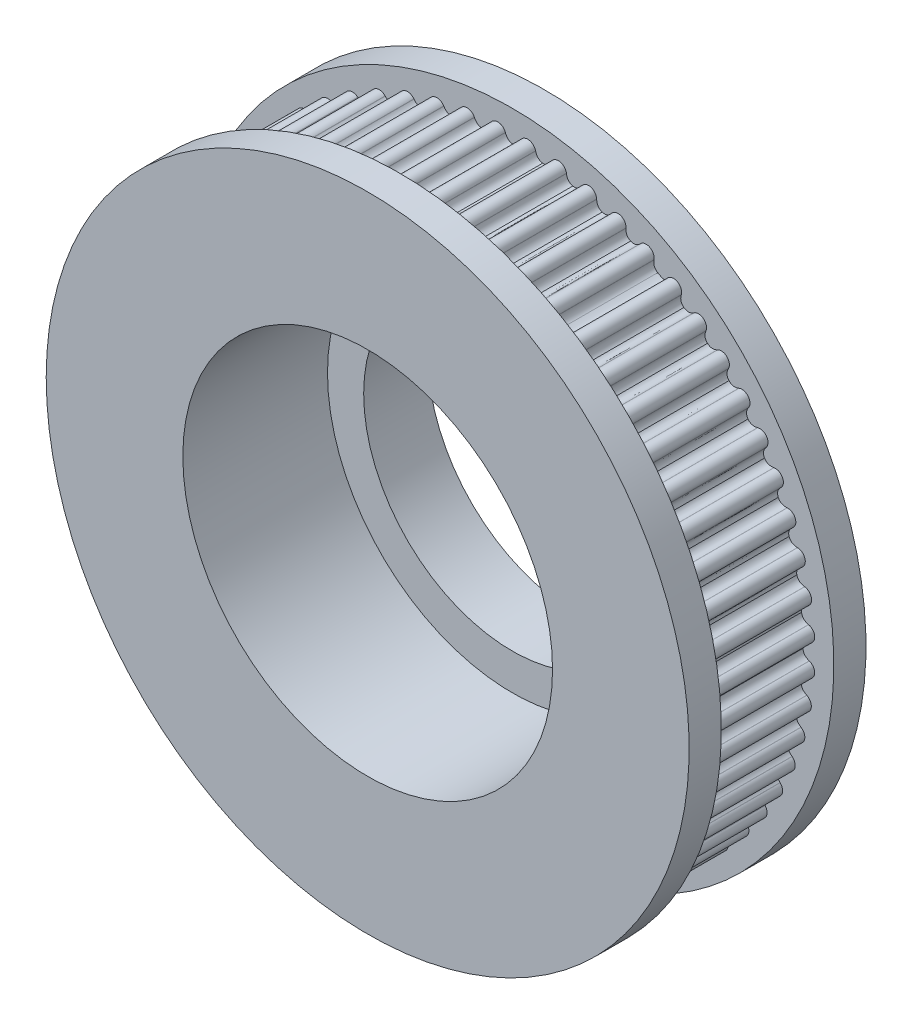
from build123d import *

# Parameters (mm, degrees)
SKETCH3_OUTSIDE_W      = 53.608
SKETCH3_OUTSIDE_H      = 53.608
CUT_EXTRUDE1_DEPTH     = 7
SPLIT1_SURFACE_1_BACK  = 59.043
SPLIT1_SURFACE_1_DEPTH = 118.086
SPLIT1_SURFACE_2_BACK  = 59.043
SPLIT1_SURFACE_2_DEPTH = 118.086


with BuildPart() as part:
    # Sketch1 → Revolve1 (revolve)
    with BuildSketch(Plane(origin=(0, 0, 0), x_dir=(0, 0, -1), z_dir=(1, 0, 0)), mode=Mode.PRIVATE) as revolve1_sk:
        Polygon((0, 11.25), (-2, 11.25), (-2, 11.5), (-2, 18.85), (-2, 20), (-4, 20), (-4, 18.85), (-11, 18.85), (-11, 20), (-13, 20), (-13, 18.85), (-13, 11.5), (-4, 11.5), (-4, 9.25), (0, 9.25), align=None)
    revolve(revolve1_sk.sketch.rotate(Axis((0, 0, 0), (0, 0, 1)), 90), axis=Axis((0, 0, 0), (0, 0, 1)))

    # Sketch3 outside → Cut-Extrude1 (cut)
    with BuildSketch(Plane.XY.offset(4)):
        Rectangle(SKETCH3_OUTSIDE_W, SKETCH3_OUTSIDE_H)
        with BuildLine():
            Line((0.48954913, 18.480375333), (0.485818632, 18.469717385))
            add(Edge.make_bspline(
                [(0.485818632, 18.469717385), (0.407741985, 18.249527558), (0.24028179, 18.086154527), (0.026214695, 18.085070307)],
                knots=[0, 0, 0, 0, 1, 1, 1, 1], degree=3))
            add(Edge.make_bspline(
                [(0.026214695, 18.085070307), (-0.187846082, 18.086775093), (-0.354832577, 18.250628249), (-0.432269829, 18.471041123)],
                knots=[0, 0, 0, 0, 1, 1, 1, 1], degree=3))
            Line((-0.432269829, 18.471041123), (-0.435971787, 18.481716895))
            ThreePointArc((-0.435971787, 18.481716895), (-0.931215069, 18.811965966), (-1.391421689, 18.434420969))
            Line((-1.391421689, 18.434420969), (-1.394049444, 18.423439012))
            add(Edge.make_bspline(
                [(-1.394049444, 18.423439012), (-1.451513615, 18.187532894), (-1.598236067, 18.015569009), (-1.838247448, 17.991333228)],
                knots=[0, 0, 0, 0, 1, 1, 1, 1], degree=3))
            add(Edge.make_bspline(
                [(-1.838247448, 17.991333228), (-2.078200755, 17.966529071), (-2.256668862, 18.105266918), (-2.36065454, 18.324677051)],
                knots=[0, 0, 0, 0, 1, 1, 1, 1], degree=3))
            Line((-2.36065454, 18.324677051), (-2.365448953, 18.334900655))
            ThreePointArc((-2.365448953, 18.334900655), (-2.892499669, 18.611573568), (-3.310721031, 18.187992112))
            Line((-3.310721031, 18.187992112), (-3.312186463, 18.176795639))
            add(Edge.make_bspline(
                [(-3.312186463, 18.176795639), (-3.344676936, 17.936175198), (-3.472620506, 17.749816677), (-3.70878375, 17.700625641)],
                knots=[0, 0, 0, 0, 1, 1, 1, 1], degree=3))
            add(Edge.make_bspline(
                [(-3.70878375, 17.700625641), (-3.944829828, 17.650875413), (-4.136822322, 17.770198244), (-4.26317296, 17.977536961)],
                knots=[0, 0, 0, 0, 1, 1, 1, 1], degree=3))
            Line((-4.26317296, 17.977536961), (-4.269009766, 17.987203407))
            ThreePointArc((-4.269009766, 17.987203407), (-4.822093437, 18.207268875), (-5.19374742, 17.742291806))
            Line((-5.19374742, 17.742291806), (-5.194034475, 17.73100349))
            add(Edge.make_bspline(
                [(-5.194034475, 17.73100349), (-5.201195276, 17.488305014), (-5.308958188, 17.289593639), (-5.538685842, 17.215986296)],
                knots=[0, 0, 0, 0, 1, 1, 1, 1], degree=3))
            add(Edge.make_bspline(
                [(-5.538685842, 17.215986296), (-5.76823852, 17.141835071), (-5.971651891, 17.240435558), (-6.118983164, 17.433431215)],
                knots=[0, 0, 0, 0, 1, 1, 1, 1], degree=3))
            Line((-6.118983164, 17.433431215), (-6.125798415, 17.442434594))
            ThreePointArc((-6.125798415, 17.442434594), (-6.698855341, 17.603481534), (-7.019870025, 17.102203239))
            Line((-7.019870025, 17.102203239), (-7.018975557, 17.090946756))
            add(Edge.make_bspline(
                [(-7.018975557, 17.090946756), (-7.000728232, 16.848829299), (-7.087129813, 16.639942195), (-7.307904932, 16.542725002)],
                knots=[0, 0, 0, 0, 1, 1, 1, 1], degree=3))
            add(Edge.make_bspline(
                [(-7.307904932, 16.542725002), (-7.528449183, 16.444985197), (-7.741054792, 16.521783053), (-7.907752509, 16.698321148)],
                knots=[0, 0, 0, 0, 1, 1, 1, 1], degree=3))
            Line((-7.907752509, 16.698321148), (-7.915471534, 16.706562818))
            ThreePointArc((-7.915471534, 16.706562818), (-8.502223183, 16.806826766), (-8.769081466, 16.274739354))
            Line((-8.769081466, 16.274739354), (-8.767015275, 16.263638033))
            add(Edge.make_bspline(
                [(-8.767015275, 16.263638033), (-8.723559745, 16.024754286), (-8.787653361, 15.807980062), (-8.997057087, 15.688218151)],
                knots=[0, 0, 0, 0, 1, 1, 1, 1], degree=3))
            add(Edge.make_bspline(
                [(-8.997057087, 15.688218151), (-9.206176582, 15.567960623), (-9.425645077, 15.622114435), (-9.609882862, 15.78026078)],
                knots=[0, 0, 0, 0, 1, 1, 1, 1], degree=3))
            Line((-9.609882862, 15.78026078), (-9.61842109, 15.787650443))
            ThreePointArc((-9.61842109, 15.787650443), (-10.212438889, 15.826032887), (-10.422217015, 15.268966019))
            Line((-10.422217015, 15.268966019), (-10.419001739, 15.258141488))
            add(Edge.make_bspline(
                [(-10.419001739, 15.258141488), (-10.350814112, 15.025108711), (-10.391897539, 14.802822392), (-10.587635602, 14.6618279)],
                knots=[0, 0, 0, 0, 1, 1, 1, 1], degree=3))
            add(Edge.make_bspline(
                [(-10.587635602, 14.6618279), (-10.783039184, 14.520370216), (-11.006966022, 14.551286663), (-11.206725327, 14.689308572)],
                knots=[0, 0, 0, 0, 1, 1, 1, 1], degree=3))
            Line((-11.206725327, 14.689308572), (-11.215989213, 14.695765267))
            ThreePointArc((-11.215989213, 14.695765267), (-11.810764978, 14.671845679), (-11.961164573, 14.095902697))
            Line((-11.961164573, 14.095902697), (-11.956835439, 14.085473551))
            add(Edge.make_bspline(
                [(-11.956835439, 14.085473551), (-11.864662793, 13.8608449), (-11.882285914, 13.635481902), (-12.062213765, 13.474799593)],
                knots=[0, 0, 0, 0, 1, 1, 1, 1], degree=3))
            add(Edge.make_bspline(
                [(-12.062213765, 13.474799593), (-12.241760551, 13.313691593), (-12.467692344, 13.321031948), (-12.680784565, 13.437417226)],
                knots=[0, 0, 0, 0, 1, 1, 1, 1], degree=3))
            Line((-12.680784565, 13.437417226), (-12.69067261, 13.442870211))
            ThreePointArc((-12.69067261, 13.442870211), (-13.279689854, 13.356910661), (-13.36906311, 12.768401715))
            Line((-13.36906311, 12.768401715), (-13.363667548, 12.75848222))
            add(Edge.make_bspline(
                [(-13.363667548, 12.75848222), (-13.248519746, 12.544718773), (-13.242489477, 12.318748218), (-13.404635791, 12.140138563)],
                knots=[0, 0, 0, 0, 1, 1, 1, 1], degree=3))
            add(Edge.make_bspline(
                [(-13.404635791, 12.140138563), (-13.566358629, 11.961145379), (-13.791820019, 11.94482922), (-14.015910473, 12.038302725)],
                knots=[0, 0, 0, 0, 1, 1, 1, 1], degree=3))
            Line((-14.015910473, 12.038302725), (-14.026314343, 12.042692255))
            ThreePointArc((-14.026314343, 12.042692255), (-14.603119668, 11.895634533), (-14.630487393, 11.301007453))
            Line((-14.630487393, 11.301007453), (-14.624084519, 11.291706287))
            add(Edge.make_bspline(
                [(-14.624084519, 11.291706287), (-14.487223144, 11.091150081), (-14.457605555, 10.867047752), (-14.600193821, 10.672467633)],
                knots=[0, 0, 0, 0, 1, 1, 1, 1], degree=3))
            add(Edge.make_bspline(
                [(-14.600193821, 10.672467633), (-14.742320842, 10.477550354), (-14.964841628, 10.437756444), (-15.197475133, 10.50729406)],
                knots=[0, 0, 0, 0, 1, 1, 1, 1], degree=3))
            Line((-15.197475133, 10.50729406), (-15.20828084, 10.510572043))
            ThreePointArc((-15.20828084, 10.510572043), (-15.766554648, 10.304027345), (-15.731616994, 9.709796987))
            Line((-15.731616994, 9.709796987), (-15.72427696, 9.701216057))
            add(Edge.make_bspline(
                [(-15.72427696, 9.701216057), (-15.567201493, 9.516064428), (-15.514321081, 9.296285636), (-15.635789073, 9.087866916)],
                knots=[0, 0, 0, 0, 1, 1, 1, 1], degree=3))
            add(Edge.make_bspline(
                [(-15.635789073, 9.087866916), (-15.756763103, 8.879161094), (-15.973905301, 8.816325423), (-16.212533075, 8.861165283)],
                knots=[0, 0, 0, 0, 1, 1, 1, 1], degree=3))
            Line((-16.212533075, 8.861165283), (-16.22362223, 8.863295805))
            ThreePointArc((-16.22362223, 8.863295805), (-16.757247956, 8.599527076), (-16.660387708, 8.012203954))
            Line((-16.660387708, 8.012203954), (-16.652190932, 8.004437273))
            add(Edge.make_bspline(
                [(-16.652190932, 8.004437273), (-16.476622326, 7.836718782), (-16.401058458, 7.623671469), (-16.500075347, 7.403697626)],
                knots=[0, 0, 0, 0, 1, 1, 1, 1], degree=3))
            add(Edge.make_bspline(
                [(-16.500075347, 7.403697626), (-16.598570971, 7.183489887), (-16.807955525, 7.098300897), (-17.049963113, 7.117951724)],
                knots=[0, 0, 0, 0, 1, 1, 1, 1], degree=3))
            Line((-17.049963113, 7.117951724), (-17.06121422, 7.118911443))
            ThreePointArc((-17.06121422, 7.118911443), (-17.564345349, 6.80080859), (-17.406623728, 6.226827538))
            Line((-17.406623728, 6.226827538), (-17.397660015, 6.2199602))
            add(Edge.make_bspline(
                [(-17.397660015, 6.2199602), (-17.205521836, 6.071512405), (-17.108102407, 5.867530763), (-17.183583343, 5.638411876)],
                knots=[0, 0, 0, 0, 1, 1, 1, 1], degree=3))
            add(Edge.make_bspline(
                [(-17.183583343, 5.638411876), (-17.258521421, 5.409114862), (-17.45785427, 5.3025059), (-17.700590186, 5.296752397)],
                knots=[0, 0, 0, 0, 1, 1, 1, 1], degree=3))
            Line((-17.700590186, 5.296752397), (-17.711879977, 5.296530797))
            ThreePointArc((-17.711879977, 5.296530797), (-18.179004098, 4.927579021), (-17.962149135, 4.373228696))
            Line((-17.962149135, 4.373228696), (-17.952516694, 4.367335942))
            add(Edge.make_bspline(
                [(-17.952516694, 4.367335942), (-17.745914049, 4.239785268), (-17.627706406, 4.047104161), (-17.678824405, 3.811350505)],
                knots=[0, 0, 0, 0, 1, 1, 1, 1], degree=3))
            add(Edge.make_bspline(
                [(-17.678824405, 3.811350505), (-17.729383899, 3.575476442), (-17.916481111, 3.448615539), (-18.157285889, 3.417520742)],
                knots=[0, 0, 0, 0, 1, 1, 1, 1], degree=3))
            Line((-18.157285889, 3.417520742), (-18.16849067, 3.416120252))
            ThreePointArc((-18.16849067, 3.416120252), (-18.594489874, 3.000361866), (-18.320877478, 2.471715846))
            Line((-18.320877478, 2.471715846), (-18.310681844, 2.466862237))
            add(Edge.make_bspline(
                [(-18.310681844, 2.466862237), (-18.091878313, 2.361606156), (-17.954177565, 2.18233664), (-17.980372566, 1.942531181)],
                knots=[0, 0, 0, 0, 1, 1, 1, 1], degree=3))
            add(Edge.make_bspline(
                [(-17.980372566, 1.942531181), (-18.005999537, 1.702664355), (-18.178811236, 1.556941425), (-18.415046569, 1.500846015)],
                knots=[0, 0, 0, 0, 1, 1, 1, 1], degree=3))
            Line((-18.415046569, 1.500846015), (-18.426043577, 1.498281978))
            ThreePointArc((-18.426043577, 1.498281978), (-18.806250528, 1.040272118), (-18.478878453, 0.543122359))
            Line((-18.478878453, 0.543122359), (-18.468231332, 0.539361073))
            add(Edge.make_bspline(
                [(-18.468231332, 0.539361073), (-18.239624173, 0.457552792), (-18.083938997, 0.293658981), (-18.084924003, 0.052429079)],
                knots=[0, 0, 0, 0, 1, 1, 1, 1], degree=3))
            add(Edge.make_bspline(
                [(-18.084924003, 0.052429079), (-18.085337676, -0.18880248), (-18.2419705, -0.351790866), (-18.471048144, -0.432272296)],
                knots=[0, 0, 0, 0, 1, 1, 1, 1], degree=3))
            Line((-18.471048144, -0.432272296), (-18.481716895, -0.435971787))
            ThreePointArc((-18.481716895, -0.435971787), (-18.811965966, -0.931215069), (-18.434420969, -1.391421689))
            Line((-18.434420969, -1.391421689), (-18.423439012, -1.394049444))
            add(Edge.make_bspline(
                [(-18.423439012, -1.394049444), (-18.187532894, -1.451513615), (-18.015569009, -1.598236067), (-17.991333228, -1.838247448)],
                knots=[0, 0, 0, 0, 1, 1, 1, 1], degree=3))
            add(Edge.make_bspline(
                [(-17.991333228, -1.838247448), (-17.966529071, -2.078200755), (-18.105266918, -2.256668862), (-18.324677051, -2.36065454)],
                knots=[0, 0, 0, 0, 1, 1, 1, 1], degree=3))
            Line((-18.324677051, -2.36065454), (-18.334900655, -2.365448953))
            ThreePointArc((-18.334900655, -2.365448953), (-18.611573568, -2.892499669), (-18.187992112, -3.310721031))
            Line((-18.187992112, -3.310721031), (-18.176795639, -3.312186463))
            add(Edge.make_bspline(
                [(-18.176795639, -3.312186463), (-17.936175198, -3.344676936), (-17.749816677, -3.472620506), (-17.700625641, -3.70878375)],
                knots=[0, 0, 0, 0, 1, 1, 1, 1], degree=3))
            add(Edge.make_bspline(
                [(-17.700625641, -3.70878375), (-17.650875413, -3.944829828), (-17.770198244, -4.136822322), (-17.977536961, -4.26317296)],
                knots=[0, 0, 0, 0, 1, 1, 1, 1], degree=3))
            Line((-17.977536961, -4.26317296), (-17.987203407, -4.269009766))
            ThreePointArc((-17.987203407, -4.269009766), (-18.207268875, -4.822093437), (-17.742291806, -5.19374742))
            Line((-17.742291806, -5.19374742), (-17.73100349, -5.194034475))
            add(Edge.make_bspline(
                [(-17.73100349, -5.194034475), (-17.488305014, -5.201195276), (-17.289593639, -5.308958188), (-17.215986296, -5.538685842)],
                knots=[0, 0, 0, 0, 1, 1, 1, 1], degree=3))
            add(Edge.make_bspline(
                [(-17.215986296, -5.538685842), (-17.141835071, -5.76823852), (-17.240435558, -5.971651891), (-17.433431215, -6.118983164)],
                knots=[0, 0, 0, 0, 1, 1, 1, 1], degree=3))
            Line((-17.433431215, -6.118983164), (-17.442434594, -6.125798415))
            ThreePointArc((-17.442434594, -6.125798415), (-17.603481534, -6.698855341), (-17.102203239, -7.019870025))
            Line((-17.102203239, -7.019870025), (-17.090946756, -7.018975557))
            add(Edge.make_bspline(
                [(-17.090946756, -7.018975557), (-16.848829299, -7.000728232), (-16.639942195, -7.087129813), (-16.542725002, -7.307904932)],
                knots=[0, 0, 0, 0, 1, 1, 1, 1], degree=3))
            add(Edge.make_bspline(
                [(-16.542725002, -7.307904932), (-16.444985197, -7.528449183), (-16.521783053, -7.741054792), (-16.698321148, -7.907752509)],
                knots=[0, 0, 0, 0, 1, 1, 1, 1], degree=3))
            Line((-16.698321148, -7.907752509), (-16.706562818, -7.915471534))
            ThreePointArc((-16.706562818, -7.915471534), (-16.806826766, -8.502223183), (-16.274739354, -8.769081466))
            Line((-16.274739354, -8.769081466), (-16.263638033, -8.767015275))
            add(Edge.make_bspline(
                [(-16.263638033, -8.767015275), (-16.024754286, -8.723559745), (-15.807980062, -8.787653361), (-15.688218151, -8.997057087)],
                knots=[0, 0, 0, 0, 1, 1, 1, 1], degree=3))
            add(Edge.make_bspline(
                [(-15.688218151, -8.997057087), (-15.567960623, -9.206176582), (-15.622114435, -9.425645077), (-15.78026078, -9.609882862)],
                knots=[0, 0, 0, 0, 1, 1, 1, 1], degree=3))
            Line((-15.78026078, -9.609882862), (-15.787650443, -9.61842109))
            ThreePointArc((-15.787650443, -9.61842109), (-15.826032887, -10.212438889), (-15.268966019, -10.422217015))
            Line((-15.268966019, -10.422217015), (-15.258141488, -10.419001739))
            add(Edge.make_bspline(
                [(-15.258141488, -10.419001739), (-15.025108711, -10.350814112), (-14.802822392, -10.391897539), (-14.6618279, -10.587635602)],
                knots=[0, 0, 0, 0, 1, 1, 1, 1], degree=3))
            add(Edge.make_bspline(
                [(-14.6618279, -10.587635602), (-14.520370216, -10.783039184), (-14.551286663, -11.006966022), (-14.689308572, -11.206725327)],
                knots=[0, 0, 0, 0, 1, 1, 1, 1], degree=3))
            Line((-14.689308572, -11.206725327), (-14.695765267, -11.215989213))
            ThreePointArc((-14.695765267, -11.215989213), (-14.671845679, -11.810764978), (-14.095902697, -11.961164573))
            Line((-14.095902697, -11.961164573), (-14.085473551, -11.956835439))
            add(Edge.make_bspline(
                [(-14.085473551, -11.956835439), (-13.8608449, -11.864662793), (-13.635481902, -11.882285914), (-13.474799593, -12.062213765)],
                knots=[0, 0, 0, 0, 1, 1, 1, 1], degree=3))
            add(Edge.make_bspline(
                [(-13.474799593, -12.062213765), (-13.313691593, -12.241760551), (-13.321031948, -12.467692344), (-13.437417226, -12.680784565)],
                knots=[0, 0, 0, 0, 1, 1, 1, 1], degree=3))
            Line((-13.437417226, -12.680784565), (-13.442870211, -12.69067261))
            ThreePointArc((-13.442870211, -12.69067261), (-13.356910661, -13.279689854), (-12.768401715, -13.36906311))
            Line((-12.768401715, -13.36906311), (-12.75848222, -13.363667548))
            add(Edge.make_bspline(
                [(-12.75848222, -13.363667548), (-12.544718773, -13.248519746), (-12.318748218, -13.242489477), (-12.140138563, -13.404635791)],
                knots=[0, 0, 0, 0, 1, 1, 1, 1], degree=3))
            add(Edge.make_bspline(
                [(-12.140138563, -13.404635791), (-11.961145379, -13.566358629), (-11.94482922, -13.791820019), (-12.038302725, -14.015910473)],
                knots=[0, 0, 0, 0, 1, 1, 1, 1], degree=3))
            Line((-12.038302725, -14.015910473), (-12.042692255, -14.026314343))
            ThreePointArc((-12.042692255, -14.026314343), (-11.895634533, -14.603119668), (-11.301007453, -14.630487393))
            Line((-11.301007453, -14.630487393), (-11.291706287, -14.624084519))
            add(Edge.make_bspline(
                [(-11.291706287, -14.624084519), (-11.091150081, -14.487223144), (-10.867047752, -14.457605555), (-10.672467633, -14.600193821)],
                knots=[0, 0, 0, 0, 1, 1, 1, 1], degree=3))
            add(Edge.make_bspline(
                [(-10.672467633, -14.600193821), (-10.477550354, -14.742320842), (-10.437756444, -14.964841628), (-10.50729406, -15.197475133)],
                knots=[0, 0, 0, 0, 1, 1, 1, 1], degree=3))
            Line((-10.50729406, -15.197475133), (-10.510572043, -15.20828084))
            ThreePointArc((-10.510572043, -15.20828084), (-10.304027345, -15.766554648), (-9.709796987, -15.731616994))
            Line((-9.709796987, -15.731616994), (-9.701216057, -15.72427696))
            add(Edge.make_bspline(
                [(-9.701216057, -15.72427696), (-9.516064428, -15.567201493), (-9.296285636, -15.514321081), (-9.087866916, -15.635789073)],
                knots=[0, 0, 0, 0, 1, 1, 1, 1], degree=3))
            add(Edge.make_bspline(
                [(-9.087866916, -15.635789073), (-8.879161094, -15.756763103), (-8.816325423, -15.973905301), (-8.861165283, -16.212533075)],
                knots=[0, 0, 0, 0, 1, 1, 1, 1], degree=3))
            Line((-8.861165283, -16.212533075), (-8.863295805, -16.22362223))
            ThreePointArc((-8.863295805, -16.22362223), (-8.599527076, -16.757247956), (-8.012203954, -16.660387708))
            Line((-8.012203954, -16.660387708), (-8.004437273, -16.652190932))
            add(Edge.make_bspline(
                [(-8.004437273, -16.652190932), (-7.836718782, -16.476622326), (-7.623671469, -16.401058458), (-7.403697626, -16.500075347)],
                knots=[0, 0, 0, 0, 1, 1, 1, 1], degree=3))
            add(Edge.make_bspline(
                [(-7.403697626, -16.500075347), (-7.183489887, -16.598570971), (-7.098300897, -16.807955525), (-7.117951724, -17.049963113)],
                knots=[0, 0, 0, 0, 1, 1, 1, 1], degree=3))
            Line((-7.117951724, -17.049963113), (-7.118911443, -17.06121422))
            ThreePointArc((-7.118911443, -17.06121422), (-6.80080859, -17.564345349), (-6.226827538, -17.406623728))
            Line((-6.226827538, -17.406623728), (-6.2199602, -17.397660015))
            add(Edge.make_bspline(
                [(-6.2199602, -17.397660015), (-6.071512405, -17.205521836), (-5.867530763, -17.108102407), (-5.638411876, -17.183583343)],
                knots=[0, 0, 0, 0, 1, 1, 1, 1], degree=3))
            add(Edge.make_bspline(
                [(-5.638411876, -17.183583343), (-5.409114862, -17.258521421), (-5.3025059, -17.45785427), (-5.296752397, -17.700590186)],
                knots=[0, 0, 0, 0, 1, 1, 1, 1], degree=3))
            Line((-5.296752397, -17.700590186), (-5.296530797, -17.711879977))
            ThreePointArc((-5.296530797, -17.711879977), (-4.927579021, -18.179004098), (-4.373228696, -17.962149135))
            Line((-4.373228696, -17.962149135), (-4.367335942, -17.952516694))
            add(Edge.make_bspline(
                [(-4.367335942, -17.952516694), (-4.239785268, -17.745914049), (-4.047104161, -17.627706406), (-3.811350505, -17.678824405)],
                knots=[0, 0, 0, 0, 1, 1, 1, 1], degree=3))
            add(Edge.make_bspline(
                [(-3.811350505, -17.678824405), (-3.575476442, -17.729383899), (-3.448615539, -17.916481111), (-3.417520742, -18.157285889)],
                knots=[0, 0, 0, 0, 1, 1, 1, 1], degree=3))
            Line((-3.417520742, -18.157285889), (-3.416120252, -18.16849067))
            ThreePointArc((-3.416120252, -18.16849067), (-3.000361866, -18.594489874), (-2.471715846, -18.320877478))
            Line((-2.471715846, -18.320877478), (-2.466862237, -18.310681844))
            add(Edge.make_bspline(
                [(-2.466862237, -18.310681844), (-2.361606156, -18.091878313), (-2.18233664, -17.954177565), (-1.942531181, -17.980372566)],
                knots=[0, 0, 0, 0, 1, 1, 1, 1], degree=3))
            add(Edge.make_bspline(
                [(-1.942531181, -17.980372566), (-1.702664355, -18.005999537), (-1.556941425, -18.178811236), (-1.500846015, -18.415046569)],
                knots=[0, 0, 0, 0, 1, 1, 1, 1], degree=3))
            Line((-1.500846015, -18.415046569), (-1.498281978, -18.426043577))
            ThreePointArc((-1.498281978, -18.426043577), (-1.040272118, -18.806250528), (-0.543122359, -18.478878453))
            Line((-0.543122359, -18.478878453), (-0.539361073, -18.468231332))
            add(Edge.make_bspline(
                [(-0.539361073, -18.468231332), (-0.457552792, -18.239624173), (-0.293658981, -18.083938997), (-0.052429079, -18.084924003)],
                knots=[0, 0, 0, 0, 1, 1, 1, 1], degree=3))
            add(Edge.make_bspline(
                [(-0.052429079, -18.084924003), (0.18880248, -18.085337676), (0.351790866, -18.2419705), (0.432272296, -18.471048144)],
                knots=[0, 0, 0, 0, 1, 1, 1, 1], degree=3))
            Line((0.432272296, -18.471048144), (0.435971787, -18.481716895))
            ThreePointArc((0.435971787, -18.481716895), (0.931215069, -18.811965966), (1.391421689, -18.434420969))
            Line((1.391421689, -18.434420969), (1.39404954, -18.423439036))
            add(Edge.make_bspline(
                [(1.39404954, -18.423439036), (1.451513615, -18.187532894), (1.598236067, -18.015569009), (1.838247448, -17.991333228)],
                knots=[0, 0, 0, 0, 1, 1, 1, 1], degree=3))
            add(Edge.make_bspline(
                [(1.838247448, -17.991333228), (2.078200755, -17.966529071), (2.256668862, -18.105266919), (2.36065454, -18.324677051)],
                knots=[0, 0, 0, 0, 1, 1, 1, 1], degree=3))
            Line((2.36065454, -18.324677051), (2.365448953, -18.334900655))
            ThreePointArc((2.365448953, -18.334900655), (2.892499669, -18.611573568), (3.310721031, -18.187992112))
            Line((3.310721031, -18.187992112), (3.312186562, -18.176795653))
            add(Edge.make_bspline(
                [(3.312186562, -18.176795653), (3.344676936, -17.936175198), (3.472620506, -17.749816677), (3.70878375, -17.700625641)],
                knots=[0, 0, 0, 0, 1, 1, 1, 1], degree=3))
            add(Edge.make_bspline(
                [(3.70878375, -17.700625641), (3.944829828, -17.650875413), (4.136822322, -17.770198244), (4.26317296, -17.977536961)],
                knots=[0, 0, 0, 0, 1, 1, 1, 1], degree=3))
            Line((4.26317296, -17.977536961), (4.269009766, -17.987203407))
            ThreePointArc((4.269009766, -17.987203407), (4.822093437, -18.207268875), (5.19374742, -17.742291806))
            Line((5.19374742, -17.742291806), (5.194034574, -17.731003493))
            add(Edge.make_bspline(
                [(5.194034574, -17.731003493), (5.201195276, -17.488305013), (5.308958188, -17.289593639), (5.538685842, -17.215986296)],
                knots=[0, 0, 0, 0, 1, 1, 1, 1], degree=3))
            add(Edge.make_bspline(
                [(5.538685842, -17.215986296), (5.76823852, -17.141835071), (5.971651891, -17.240435558), (6.118983164, -17.433431215)],
                knots=[0, 0, 0, 0, 1, 1, 1, 1], degree=3))
            Line((6.118983164, -17.433431215), (6.125798415, -17.442434594))
            ThreePointArc((6.125798415, -17.442434594), (6.698855341, -17.603481534), (7.019870025, -17.102203239))
            Line((7.019870025, -17.102203239), (7.018975656, -17.090946748))
            add(Edge.make_bspline(
                [(7.018975656, -17.090946748), (7.000728232, -16.848829299), (7.087129813, -16.639942195), (7.307904932, -16.542725002)],
                knots=[0, 0, 0, 0, 1, 1, 1, 1], degree=3))
            add(Edge.make_bspline(
                [(7.307904932, -16.542725002), (7.528449183, -16.444985197), (7.741054792, -16.521783053), (7.907752509, -16.698321148)],
                knots=[0, 0, 0, 0, 1, 1, 1, 1], degree=3))
            Line((7.907752509, -16.698321148), (7.915471534, -16.706562818))
            ThreePointArc((7.915471534, -16.706562818), (8.502223183, -16.806826766), (8.769081466, -16.274739354))
            Line((8.769081466, -16.274739354), (8.767015373, -16.263638015))
            add(Edge.make_bspline(
                [(8.767015373, -16.263638015), (8.723559745, -16.024754286), (8.787653361, -15.807980062), (8.997057087, -15.688218151)],
                knots=[0, 0, 0, 0, 1, 1, 1, 1], degree=3))
            add(Edge.make_bspline(
                [(8.997057087, -15.688218151), (9.206176582, -15.567960623), (9.425645077, -15.622114435), (9.609882862, -15.78026078)],
                knots=[0, 0, 0, 0, 1, 1, 1, 1], degree=3))
            Line((9.609882862, -15.78026078), (9.61842109, -15.787650443))
            ThreePointArc((9.61842109, -15.787650443), (10.212438889, -15.826032887), (10.422217015, -15.268966019))
            Line((10.422217015, -15.268966019), (10.419001834, -15.25814146))
            add(Edge.make_bspline(
                [(10.419001834, -15.25814146), (10.350814112, -15.025108711), (10.391897539, -14.802822392), (10.587635602, -14.6618279)],
                knots=[0, 0, 0, 0, 1, 1, 1, 1], degree=3))
            add(Edge.make_bspline(
                [(10.587635602, -14.6618279), (10.783039184, -14.520370216), (11.006966022, -14.551286663), (11.206725327, -14.689308572)],
                knots=[0, 0, 0, 0, 1, 1, 1, 1], degree=3))
            Line((11.206725327, -14.689308572), (11.215989213, -14.695765267))
            ThreePointArc((11.215989213, -14.695765267), (11.810764978, -14.671845679), (11.961164573, -14.095902697))
            Line((11.961164573, -14.095902697), (11.956835531, -14.085473514))
            add(Edge.make_bspline(
                [(11.956835531, -14.085473514), (11.864662793, -13.8608449), (11.882285914, -13.635481902), (12.062213765, -13.474799593)],
                knots=[0, 0, 0, 0, 1, 1, 1, 1], degree=3))
            add(Edge.make_bspline(
                [(12.062213765, -13.474799593), (12.241760551, -13.313691593), (12.467692344, -13.321031948), (12.680784565, -13.437417226)],
                knots=[0, 0, 0, 0, 1, 1, 1, 1], degree=3))
            Line((12.680784565, -13.437417226), (12.69067261, -13.442870211))
            ThreePointArc((12.69067261, -13.442870211), (13.279689854, -13.356910661), (13.36906311, -12.768401715))
            Line((13.36906311, -12.768401715), (13.363667636, -12.758482173))
            add(Edge.make_bspline(
                [(13.363667636, -12.758482173), (13.248519746, -12.544718773), (13.242489477, -12.318748218), (13.404635791, -12.140138563)],
                knots=[0, 0, 0, 0, 1, 1, 1, 1], degree=3))
            add(Edge.make_bspline(
                [(13.404635791, -12.140138563), (13.566358629, -11.961145379), (13.791820019, -11.94482922), (14.015910473, -12.038302725)],
                knots=[0, 0, 0, 0, 1, 1, 1, 1], degree=3))
            Line((14.015910473, -12.038302725), (14.026314343, -12.042692255))
            ThreePointArc((14.026314343, -12.042692255), (14.603119668, -11.895634533), (14.630487393, -11.301007453))
            Line((14.630487393, -11.301007453), (14.624084601, -11.291706231))
            add(Edge.make_bspline(
                [(14.624084601, -11.291706231), (14.487223144, -11.091150081), (14.457605555, -10.867047752), (14.600193821, -10.672467633)],
                knots=[0, 0, 0, 0, 1, 1, 1, 1], degree=3))
            add(Edge.make_bspline(
                [(14.600193821, -10.672467633), (14.742320842, -10.477550354), (14.964841628, -10.437756444), (15.197475133, -10.50729406)],
                knots=[0, 0, 0, 0, 1, 1, 1, 1], degree=3))
            Line((15.197475133, -10.50729406), (15.20828084, -10.510572043))
            ThreePointArc((15.20828084, -10.510572043), (15.766554648, -10.304027345), (15.731616994, -9.709796987))
            Line((15.731616994, -9.709796987), (15.724277035, -9.701215992))
            add(Edge.make_bspline(
                [(15.724277035, -9.701215992), (15.567201493, -9.516064428), (15.514321081, -9.296285636), (15.635789073, -9.087866916)],
                knots=[0, 0, 0, 0, 1, 1, 1, 1], degree=3))
            add(Edge.make_bspline(
                [(15.635789073, -9.087866916), (15.756763103, -8.879161094), (15.973905301, -8.816325423), (16.212533075, -8.861165283)],
                knots=[0, 0, 0, 0, 1, 1, 1, 1], degree=3))
            Line((16.212533075, -8.861165283), (16.22362223, -8.863295805))
            ThreePointArc((16.22362223, -8.863295805), (16.757247956, -8.599527076), (16.660387708, -8.012203954))
            Line((16.660387708, -8.012203954), (16.652191, -8.004437202))
            add(Edge.make_bspline(
                [(16.652191, -8.004437202), (16.476622326, -7.836718782), (16.401058458, -7.623671469), (16.500075347, -7.403697626)],
                knots=[0, 0, 0, 0, 1, 1, 1, 1], degree=3))
            add(Edge.make_bspline(
                [(16.500075347, -7.403697626), (16.598570971, -7.183489887), (16.807955525, -7.098300897), (17.049963113, -7.117951724)],
                knots=[0, 0, 0, 0, 1, 1, 1, 1], degree=3))
            Line((17.049963113, -7.117951724), (17.06121422, -7.118911443))
            ThreePointArc((17.06121422, -7.118911443), (17.564345349, -6.80080859), (17.406623728, -6.226827538))
            Line((17.406623728, -6.226827538), (17.397660075, -6.219960122))
            add(Edge.make_bspline(
                [(17.397660075, -6.219960122), (17.205521836, -6.071512405), (17.108102407, -5.867530763), (17.183583343, -5.638411876)],
                knots=[0, 0, 0, 0, 1, 1, 1, 1], degree=3))
            add(Edge.make_bspline(
                [(17.183583343, -5.638411876), (17.258521421, -5.409114862), (17.45785427, -5.3025059), (17.700590186, -5.296752397)],
                knots=[0, 0, 0, 0, 1, 1, 1, 1], degree=3))
            Line((17.700590186, -5.296752397), (17.711879977, -5.296530797))
            ThreePointArc((17.711879977, -5.296530797), (18.179004098, -4.927579021), (17.962149135, -4.373228696))
            Line((17.962149135, -4.373228696), (17.952516746, -4.367335857))
            add(Edge.make_bspline(
                [(17.952516746, -4.367335857), (17.745914049, -4.239785268), (17.627706406, -4.047104161), (17.678824405, -3.811350505)],
                knots=[0, 0, 0, 0, 1, 1, 1, 1], degree=3))
            add(Edge.make_bspline(
                [(17.678824405, -3.811350505), (17.729383899, -3.575476442), (17.916481111, -3.448615539), (18.157285889, -3.417520742)],
                knots=[0, 0, 0, 0, 1, 1, 1, 1], degree=3))
            Line((18.157285889, -3.417520742), (18.16849067, -3.416120252))
            ThreePointArc((18.16849067, -3.416120252), (18.594489874, -3.000361866), (18.320877478, -2.471715846))
            Line((18.320877478, -2.471715846), (18.310681887, -2.466862147))
            add(Edge.make_bspline(
                [(18.310681887, -2.466862147), (18.091878313, -2.361606156), (17.954177565, -2.18233664), (17.980372566, -1.942531181)],
                knots=[0, 0, 0, 0, 1, 1, 1, 1], degree=3))
            add(Edge.make_bspline(
                [(17.980372566, -1.942531181), (18.005999537, -1.702664355), (18.178811236, -1.556941425), (18.415046569, -1.500846015)],
                knots=[0, 0, 0, 0, 1, 1, 1, 1], degree=3))
            Line((18.415046569, -1.500846015), (18.426043577, -1.498281978))
            ThreePointArc((18.426043577, -1.498281978), (18.806250528, -1.040272118), (18.478878453, -0.543122359))
            Line((18.478878453, -0.543122359), (18.468231365, -0.539360979))
            add(Edge.make_bspline(
                [(18.468231365, -0.539360979), (18.239624173, -0.457552792), (18.083938997, -0.293658981), (18.084924003, -0.052429079)],
                knots=[0, 0, 0, 0, 1, 1, 1, 1], degree=3))
            add(Edge.make_bspline(
                [(18.084924003, -0.052429079), (18.085337676, 0.18880248), (18.2419705, 0.351790866), (18.471048144, 0.432272296)],
                knots=[0, 0, 0, 0, 1, 1, 1, 1], degree=3))
            Line((18.471048144, 0.432272296), (18.481716895, 0.435971787))
            ThreePointArc((18.481716895, 0.435971787), (18.811965966, 0.931215069), (18.434420969, 1.391421689))
            Line((18.434420969, 1.391421689), (18.423439036, 1.39404954))
            add(Edge.make_bspline(
                [(18.423439036, 1.39404954), (18.187532894, 1.451513615), (18.015569009, 1.598236067), (17.991333228, 1.838247448)],
                knots=[0, 0, 0, 0, 1, 1, 1, 1], degree=3))
            add(Edge.make_bspline(
                [(17.991333228, 1.838247448), (17.966529071, 2.078200755), (18.105266919, 2.256668862), (18.324677051, 2.36065454)],
                knots=[0, 0, 0, 0, 1, 1, 1, 1], degree=3))
            Line((18.324677051, 2.36065454), (18.334900655, 2.365448953))
            ThreePointArc((18.334900655, 2.365448953), (18.611573568, 2.892499669), (18.187992112, 3.310721031))
            Line((18.187992112, 3.310721031), (18.176795653, 3.312186562))
            add(Edge.make_bspline(
                [(18.176795653, 3.312186562), (17.936175198, 3.344676936), (17.749816677, 3.472620506), (17.700625641, 3.70878375)],
                knots=[0, 0, 0, 0, 1, 1, 1, 1], degree=3))
            add(Edge.make_bspline(
                [(17.700625641, 3.70878375), (17.650875413, 3.944829828), (17.770198244, 4.136822322), (17.977536961, 4.26317296)],
                knots=[0, 0, 0, 0, 1, 1, 1, 1], degree=3))
            Line((17.977536961, 4.26317296), (17.987203407, 4.269009766))
            ThreePointArc((17.987203407, 4.269009766), (18.207268875, 4.822093437), (17.742291806, 5.19374742))
            Line((17.742291806, 5.19374742), (17.731003493, 5.194034574))
            add(Edge.make_bspline(
                [(17.731003493, 5.194034574), (17.488305013, 5.201195276), (17.289593639, 5.308958188), (17.215986296, 5.538685842)],
                knots=[0, 0, 0, 0, 1, 1, 1, 1], degree=3))
            add(Edge.make_bspline(
                [(17.215986296, 5.538685842), (17.141835071, 5.76823852), (17.240435558, 5.971651891), (17.433431215, 6.118983164)],
                knots=[0, 0, 0, 0, 1, 1, 1, 1], degree=3))
            Line((17.433431215, 6.118983164), (17.442434594, 6.125798415))
            ThreePointArc((17.442434594, 6.125798415), (17.603481534, 6.698855341), (17.102203239, 7.019870025))
            Line((17.102203239, 7.019870025), (17.090946748, 7.018975656))
            add(Edge.make_bspline(
                [(17.090946748, 7.018975656), (16.848829299, 7.000728232), (16.639942195, 7.087129813), (16.542725002, 7.307904932)],
                knots=[0, 0, 0, 0, 1, 1, 1, 1], degree=3))
            add(Edge.make_bspline(
                [(16.542725002, 7.307904932), (16.444985197, 7.528449183), (16.521783053, 7.741054792), (16.698321148, 7.907752509)],
                knots=[0, 0, 0, 0, 1, 1, 1, 1], degree=3))
            Line((16.698321148, 7.907752509), (16.706562818, 7.915471534))
            ThreePointArc((16.706562818, 7.915471534), (16.806826766, 8.502223183), (16.274739354, 8.769081466))
            Line((16.274739354, 8.769081466), (16.263638015, 8.767015373))
            add(Edge.make_bspline(
                [(16.263638015, 8.767015373), (16.024754286, 8.723559745), (15.807980062, 8.787653361), (15.688218151, 8.997057087)],
                knots=[0, 0, 0, 0, 1, 1, 1, 1], degree=3))
            add(Edge.make_bspline(
                [(15.688218151, 8.997057087), (15.567960623, 9.206176582), (15.622114435, 9.425645077), (15.78026078, 9.609882862)],
                knots=[0, 0, 0, 0, 1, 1, 1, 1], degree=3))
            Line((15.78026078, 9.609882862), (15.787650443, 9.61842109))
            ThreePointArc((15.787650443, 9.61842109), (15.826032887, 10.212438889), (15.268966019, 10.422217015))
            Line((15.268966019, 10.422217015), (15.25814146, 10.419001834))
            add(Edge.make_bspline(
                [(15.25814146, 10.419001834), (15.025108711, 10.350814112), (14.802822392, 10.391897539), (14.6618279, 10.587635602)],
                knots=[0, 0, 0, 0, 1, 1, 1, 1], degree=3))
            add(Edge.make_bspline(
                [(14.6618279, 10.587635602), (14.520370216, 10.783039184), (14.551286663, 11.006966022), (14.689308572, 11.206725327)],
                knots=[0, 0, 0, 0, 1, 1, 1, 1], degree=3))
            Line((14.689308572, 11.206725327), (14.695765267, 11.215989213))
            ThreePointArc((14.695765267, 11.215989213), (14.671845679, 11.810764978), (14.095902697, 11.961164573))
            Line((14.095902697, 11.961164573), (14.085473514, 11.956835531))
            add(Edge.make_bspline(
                [(14.085473514, 11.956835531), (13.8608449, 11.864662793), (13.635481902, 11.882285914), (13.474799593, 12.062213765)],
                knots=[0, 0, 0, 0, 1, 1, 1, 1], degree=3))
            add(Edge.make_bspline(
                [(13.474799593, 12.062213765), (13.313691593, 12.241760551), (13.321031948, 12.467692344), (13.437417226, 12.680784565)],
                knots=[0, 0, 0, 0, 1, 1, 1, 1], degree=3))
            Line((13.437417226, 12.680784565), (13.442870211, 12.69067261))
            ThreePointArc((13.442870211, 12.69067261), (13.356910661, 13.279689854), (12.768401715, 13.36906311))
            Line((12.768401715, 13.36906311), (12.758482173, 13.363667636))
            add(Edge.make_bspline(
                [(12.758482173, 13.363667636), (12.544718773, 13.248519746), (12.318748218, 13.242489477), (12.140138563, 13.404635791)],
                knots=[0, 0, 0, 0, 1, 1, 1, 1], degree=3))
            add(Edge.make_bspline(
                [(12.140138563, 13.404635791), (11.961145379, 13.566358629), (11.94482922, 13.791820019), (12.038302725, 14.015910473)],
                knots=[0, 0, 0, 0, 1, 1, 1, 1], degree=3))
            Line((12.038302725, 14.015910473), (12.042692255, 14.026314343))
            ThreePointArc((12.042692255, 14.026314343), (11.895634533, 14.603119668), (11.301007453, 14.630487393))
            Line((11.301007453, 14.630487393), (11.291706231, 14.624084601))
            add(Edge.make_bspline(
                [(11.291706231, 14.624084601), (11.091150081, 14.487223144), (10.867047752, 14.457605555), (10.672467633, 14.600193821)],
                knots=[0, 0, 0, 0, 1, 1, 1, 1], degree=3))
            add(Edge.make_bspline(
                [(10.672467633, 14.600193821), (10.477550354, 14.742320842), (10.437756444, 14.964841628), (10.50729406, 15.197475133)],
                knots=[0, 0, 0, 0, 1, 1, 1, 1], degree=3))
            Line((10.50729406, 15.197475133), (10.510572043, 15.20828084))
            ThreePointArc((10.510572043, 15.20828084), (10.304027345, 15.766554648), (9.709796987, 15.731616994))
            Line((9.709796987, 15.731616994), (9.701215992, 15.724277035))
            add(Edge.make_bspline(
                [(9.701215992, 15.724277035), (9.516064428, 15.567201493), (9.599334459, 15.33876957), (9.0425, 15.662069427)],
                knots=[0, 0, 0, 0, 1, 1, 1, 1], degree=3))
            add(Edge.make_bspline(
                [(9.0425, 15.662069427), (8.833444347, 15.782437904), (8.769979438, 15.999397026), (8.814127318, 16.23815379)],
                knots=[0, 0, 0, 0, 1, 1, 1, 1], degree=3))
            Line((8.814127318, 16.23815379), (8.816225683, 16.249249075))
            ThreePointArc((8.816225683, 16.249249075), (8.550911063, 16.782107883), (7.96387121, 16.683545371))
            Line((7.96387121, 16.683545371), (7.956128252, 16.675326181))
            add(Edge.make_bspline(
                [(7.956128252, 16.675326181), (7.788919518, 16.499272023), (7.576092163, 16.423090841), (7.35583219, 16.521469601)],
                knots=[0, 0, 0, 0, 1, 1, 1, 1], degree=3))
            add(Edge.make_bspline(
                [(7.35583219, 16.521469601), (7.135339834, 16.619326421), (7.049544188, 16.828463129), (7.068493344, 17.070526668)],
                knots=[0, 0, 0, 0, 1, 1, 1, 1], degree=3))
            Line((7.068493344, 17.070526668), (7.069420441, 17.081780511))
            ThreePointArc((7.069420441, 17.081780511), (6.74986033, 17.583987333), (6.176338931, 17.424602383))
            Line((6.176338931, 17.424602383), (6.169497529, 17.415618859))
            add(Edge.make_bspline(
                [(6.169497529, 17.415618859), (6.021607452, 17.223051072), (5.817909089, 17.125040702), (5.588572343, 17.199857097)],
                knots=[0, 0, 0, 0, 1, 1, 1, 1], degree=3))
            add(Edge.make_bspline(
                [(5.588572343, 17.199857097), (5.359059045, 17.274130119), (5.251872657, 17.473153068), (5.245415478, 17.715871284)],
                knots=[0, 0, 0, 0, 1, 1, 1, 1], degree=3))
            Line((5.245415478, 17.715871284), (5.24516115, 17.727160385))
            ThreePointArc((5.24516115, 17.727160385), (4.874856715, 18.193212938), (4.32113739, 17.974751805))
            Line((4.32113739, 17.974751805), (4.3152725, 17.965102373))
            add(Edge.make_bspline(
                [(4.3152725, 17.965102373), (4.188321395, 17.75813077), (3.995983787, 17.639365034), (3.760082928, 17.689799359)],
                knots=[0, 0, 0, 0, 1, 1, 1, 1], degree=3))
            add(Edge.make_bspline(
                [(3.760082928, 17.689799359), (3.524063283, 17.739674834), (3.396660511, 17.926403485), (3.364867742, 18.167117107)],
                knots=[0, 0, 0, 0, 1, 1, 1, 1], degree=3))
            Line((3.364867742, 18.167117107), (3.363434775, 18.17831778))
            ThreePointArc((3.363434775, 18.17831778), (2.946443149, 18.603109895), (2.418592563, 18.327966085))
            Line((2.418592563, 18.327966085), (2.413768442, 18.317756465))
            add(Edge.make_bspline(
                [(2.413768442, 18.317756465), (2.309147212, 18.09864867), (2.130277649, 17.960428791), (1.890397258, 17.985928478)],
                knots=[0, 0, 0, 0, 1, 1, 1, 1], degree=3))
            add(Edge.make_bspline(
                [(1.890397258, 17.985928478), (1.650457146, 18.010859958), (1.504233841, 18.183248475), (1.447453812, 18.419320192)],
                knots=[0, 0, 0, 0, 1, 1, 1, 1], degree=3))
            Line((1.447453812, 18.419320192), (1.444857905, 18.430309721))
            ThreePointArc((1.444857905, 18.430309721), (0.985747736, 18.809187287), (0.48954913, 18.480375333))
        make_face(mode=Mode.SUBTRACT)
    extrude(amount=CUT_EXTRUDE1_DEPTH, mode=Mode.SUBTRACT)


with BuildPart() as body_2:
    # Split1: the piece behind the surface
    add(part.part)
    # Split1 surface: a surface, the sketch's curves swept straight by 118.086 mm
    with BuildLine(Plane(origin=(0, 0, 0), x_dir=(0, 0, -1), z_dir=(1, 0, 0)).offset(-SPLIT1_SURFACE_1_BACK), mode=Mode.PRIVATE) as split1_surface_1_path:
        Line((-4, 21.474694962), (-4, -21.271336108))
    split1_surface_1 = Shell.extrude(split1_surface_1_path.wire(), (1 * SPLIT1_SURFACE_1_DEPTH, 0 * SPLIT1_SURFACE_1_DEPTH, 0 * SPLIT1_SURFACE_1_DEPTH))
    split(bisect_by=split1_surface_1, keep=Keep.BOTTOM)


with BuildPart() as part_1:
    add(part.part)

    # Split1: split by a surface, the side it looks to stays
    # Split1 surface: a surface, the sketch's curves swept straight by 118.086 mm
    with BuildLine(Plane(origin=(0, 0, 0), x_dir=(0, 0, -1), z_dir=(1, 0, 0)).offset(-SPLIT1_SURFACE_2_BACK), mode=Mode.PRIVATE) as split1_surface_2_path:
        Line((-4, 21.474694962), (-4, -21.271336108))
    split1_surface_2 = Shell.extrude(split1_surface_2_path.wire(), (1 * SPLIT1_SURFACE_2_DEPTH, 0 * SPLIT1_SURFACE_2_DEPTH, 0 * SPLIT1_SURFACE_2_DEPTH))
    split(bisect_by=split1_surface_2, keep=Keep.TOP)


solid = Compound([body_2.part, part_1.part])
